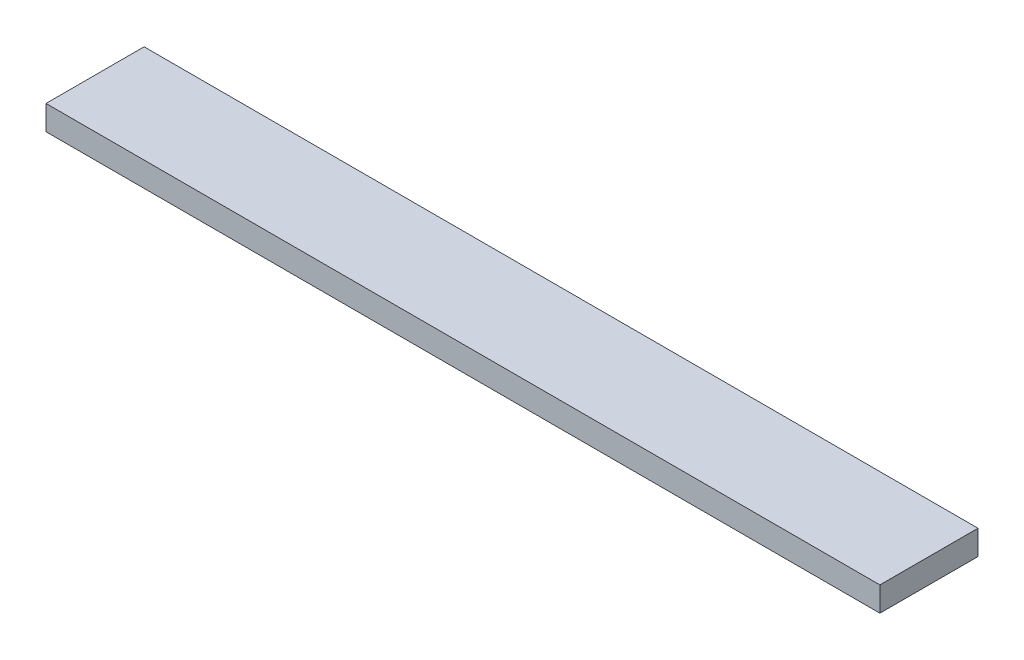
from build123d import *

# Parameters (mm, degrees)
SKETCH1_W           = 170
SKETCH1_H           = 5
BOSS_EXTRUDE1_DEPTH = 20


with BuildPart() as part:
    # Sketch1 → Boss-Extrude1 (new body)
    with BuildSketch(Plane.XY):
        Rectangle(SKETCH1_W, SKETCH1_H)
    extrude(amount=BOSS_EXTRUDE1_DEPTH)


solid = part.part
